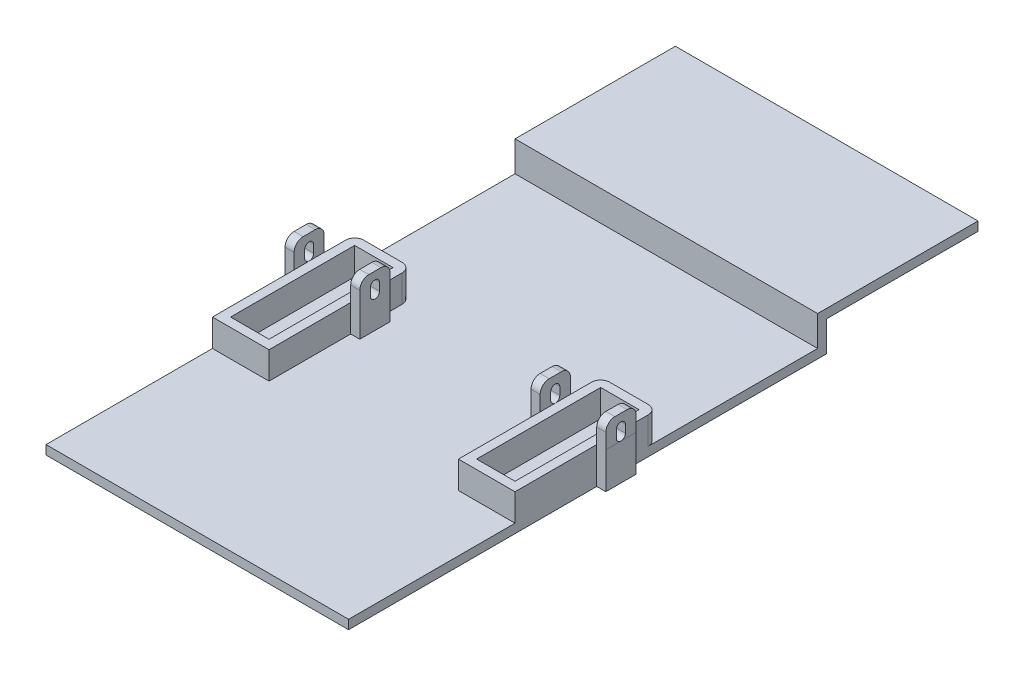
from build123d import *

# Parameters (mm, degrees)
ESBO_O1_W                = 100
ESBO_O1_H                = 100
EXTRUS_O1_DEPTH          = 3
EXTRUS_O2_DEPTH          = 9
ESBO_O3_W                = 12.7
ESBO_O3_H                = 41
EXTRUS_O3_DEPTH          = 9
FILETE2_R                = 3
ESBO_O6_W                = 3
ESBO_O6_H                = 10
EXTRUS_O4_DEPTH          = 3
ESBO_O7_W                = 3
ESBO_O7_H                = 10
EXTRUS_O5_DEPTH          = 17
EXTRUS_O6_DEPTH          = 8
FILETE3_R                = 3
FILETE2_OF_ESPELHAR4_R   = 3
FILETE3_OF_ESPELHAR4_R   = 3
EXTRUS_O17_DEPTH         = 10
EXTRUS_O30_DEPTH         = 10
ESBO_O22_W               = 100
ESBO_O22_H               = 3
EXTRUS_O33_DEPTH         = 53
ESBO_O23_W               = 100
ESBO_O23_H               = 53
EXTRUS_O35_DEPTH         = 10
ESBO_O24_W               = 50
ESBO_O24_H               = 10
EXTRUS_O36_DEPTH         = 148.030904796
RESSALTO_EXTRUS_O1_DEPTH = 55


with BuildPart() as part:
    # Esboço1 → Extrusão1 (new body)
    with BuildSketch(Plane(origin=(0, 0, 0), x_dir=(1, 0, 0), z_dir=(0, 1, 0))):
        Rectangle(ESBO_O1_W, ESBO_O1_H)
    extrus_o1 = extrude(amount=EXTRUS_O1_DEPTH)

    # Esboço2 → Extrusão2 (add)
    with BuildSketch(Plane(origin=(0, 3, 0), x_dir=(1, 0, 0), z_dir=(0, 1, 0))):
        Polygon((-50, -3), (-31.3, -3), (-31.3, -50), (-50, -50), (-50, -23), (-53, -23), (-53, -13), (-50, -13), align=None)
    extrus_o2 = extrude(amount=EXTRUS_O2_DEPTH)

    # Esboço3 → Extrusão3 (cut)
    with BuildSketch(Plane(origin=(0, 12, 0), x_dir=(-1, 0, 0), z_dir=(0, 1, 0))):
        with Locations((40.65, 26.5)):
            Rectangle(ESBO_O3_W, ESBO_O3_H)
    extrus_o3 = extrude(amount=-EXTRUS_O3_DEPTH, mode=Mode.SUBTRACT)

    # Filete2
    filete2_edges = [part.edges().sort_by_distance(p)[0] for p in [
        (-50, 7.5, 3),
        (-31.3, 7.5, 3),
    ]]
    fillet(filete2_edges, radius=FILETE2_R)

    # Esboço6 → Extrusão4 (add)
    with BuildSketch(Plane.XZ.offset(-3)):
        with Locations((-51.5, 18)):
            Rectangle(ESBO_O6_W, ESBO_O6_H)
    extrus_o4 = extrude(amount=EXTRUS_O4_DEPTH)

    # Esboço7 → Extrusão5 (add)
    with BuildSketch(Plane(origin=(0, 3, 0), x_dir=(1, 0, 0), z_dir=(0, 1, 0))):
        with Locations((-29.8, -18)):
            Rectangle(ESBO_O7_W, ESBO_O7_H)
    extrus_o5 = extrude(amount=EXTRUS_O5_DEPTH)

    # Esboço8 → Extrusão6 (add)
    with BuildSketch(Plane(origin=(0, 12, 0), x_dir=(1, 0, 0), z_dir=(0, 1, 0))):
        Polygon((-53.00042216, -13), (-50.053356487, -13), (-50, -23), (-53, -23), align=None)
    extrus_o6 = extrude(amount=EXTRUS_O6_DEPTH)

    # Filete3
    filete3_edges = [part.edges().sort_by_distance(p)[0] for p in [
        (-51.5, 20, 23),
        (-51.526889323, 20, 13),
        (-29.8, 20, 23),
        (-29.8, 20, 13),
    ]]
    fillet(filete3_edges, radius=FILETE3_R)

    # Espelhar4: Extrusão1, Extrusão2, Extrusão3, Extrusão4, Extrusão5, Extrusão6 across plane
    add(extrus_o1.mirror(Plane(origin=(0, 0, 0), x_dir=(0, 0, 1), z_dir=(1, 0, 0))))
    add(extrus_o2.mirror(Plane(origin=(0, 0, 0), x_dir=(0, 0, 1), z_dir=(1, 0, 0))))
    add(extrus_o3.mirror(Plane(origin=(0, 0, 0), x_dir=(0, 0, 1), z_dir=(1, 0, 0))), mode=Mode.SUBTRACT)
    add(extrus_o4.mirror(Plane(origin=(0, 0, 0), x_dir=(0, 0, 1), z_dir=(1, 0, 0))))
    add(extrus_o5.mirror(Plane(origin=(0, 0, 0), x_dir=(0, 0, 1), z_dir=(1, 0, 0))))
    add(extrus_o6.mirror(Plane(origin=(0, 0, 0), x_dir=(0, 0, 1), z_dir=(1, 0, 0))))

    # Filete2 of Espelhar4
    filete2_of_espelhar4_edges = [part.edges().sort_by_distance(p)[0] for p in [
        (50, 7.5, 3),
        (31.3, 7.5, 3),
    ]]
    fillet(filete2_of_espelhar4_edges, radius=FILETE2_OF_ESPELHAR4_R)

    # Filete3 of Espelhar4
    filete3_of_espelhar4_edges = [part.edges().sort_by_distance(p)[0] for p in [
        (51.5, 20, 23),
        (51.526889323, 20, 13),
        (29.8, 20, 23),
        (29.8, 20, 13),
    ]]
    fillet(filete3_of_espelhar4_edges, radius=FILETE3_OF_ESPELHAR4_R)

    # Esboço9 → Extrusão17 (cut)
    with BuildSketch(Plane(origin=(-28.3, 0, 0), x_dir=(0, 0, -1), z_dir=(1, 0, 0))):
        with BuildLine():
            ThreePointArc((-18, 17.5), (-19.060660172, 17.060660172), (-19.5, 16))
            Line((-19.5, 16), (-19.5, 13.5))
            ThreePointArc((-19.5, 13.5), (-19.060660172, 12.439339828), (-18, 12))
            ThreePointArc((-18, 12), (-16.939339828, 12.439339828), (-16.5, 13.5))
            Line((-16.5, 13.5), (-16.5, 16))
            ThreePointArc((-16.5, 16), (-16.939339828, 17.060660172), (-18, 17.5))
        make_face()
    extrus_o17 = extrude(amount=-EXTRUS_O17_DEPTH, mode=Mode.SUBTRACT)

    # Esboço15 → Extrusão30 (cut)
    with BuildSketch(Plane(origin=(-50.121293009, 0, 0.267429611), x_dir=(-0.005335572730928429, 0, -0.9999857657305093), z_dir=(0.9999857657305093, 0, -0.005335572730928429))):
        with BuildLine():
            Line((-19.232893975, 16.01), (-19.232893975, 13.51))
            ThreePointArc((-19.232893975, 13.51), (-17.732893975, 12.01), (-16.232893975, 13.51))
            Line((-16.232893975, 13.51), (-16.232893975, 16.01))
            ThreePointArc((-16.232893975, 16.01), (-17.732893975, 17.51), (-19.232893975, 16.01))
        make_face()
    extrus_o30 = extrude(amount=-EXTRUS_O30_DEPTH, mode=Mode.SUBTRACT)

    # Espelhar14: Extrusão17, Extrusão30 across plane
    add(extrus_o17.mirror(Plane(origin=(0, 0, 0), x_dir=(0, 0, 1), z_dir=(1, 0, 0))), mode=Mode.SUBTRACT)
    add(extrus_o30.mirror(Plane(origin=(0, 0, 0), x_dir=(0, 0, 1), z_dir=(1, 0, 0))), mode=Mode.SUBTRACT)

    # Esboço22 → Extrusão33 (add)
    with BuildSketch(Plane(origin=(0, 0, -50), x_dir=(-1, 0, 0), z_dir=(0, 0, -1))):
        with Locations((0, 1.5)):
            Rectangle(ESBO_O22_W, ESBO_O22_H)
    extrude(amount=EXTRUS_O33_DEPTH)

    # Esboço23 → Extrusão35 (add)
    with BuildSketch(Plane(origin=(0, 3, 0), x_dir=(1, 0, 0), z_dir=(0, 1, 0))):
        with Locations((0, 76.5)):
            Rectangle(ESBO_O23_W, ESBO_O23_H)
    extrude(amount=EXTRUS_O35_DEPTH)

    # Esboço24 → Extrusão36 (cut, through all)
    with BuildSketch(Plane(origin=(50, 0, 0), x_dir=(0, 0, -1), z_dir=(1, 0, 0))):
        with Locations((78, 5)):
            Rectangle(ESBO_O24_W, ESBO_O24_H)
    extrude(amount=-EXTRUS_O36_DEPTH, mode=Mode.SUBTRACT)

    # Esboço26 → Ressalto-extrusão1 (add)
    with BuildSketch(Plane.XY.offset(50)):
        Polygon((31.3, 3), (-31.3, 3), (-50, 3), (-50, 0), (50, 0), (50, 3), align=None)
    extrude(amount=RESSALTO_EXTRUS_O1_DEPTH)


solid = part.part
